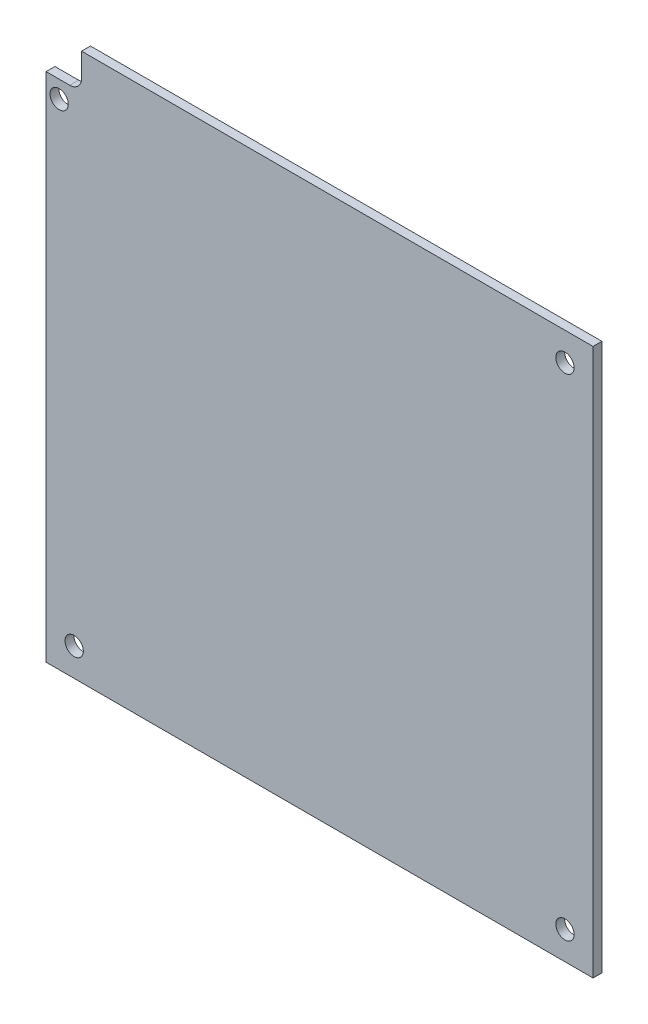
from build123d import *

# Parameters (mm, degrees)
SKETCH1_W                  = 92.5
SKETCH1_H                  = 92.5
BOSS_EXTRUDE1_DEPTH        = 1.5
F_3_1_3_1_DIAMETER_HOLE1_D = 3.1
CUT_EXTRUDE1_DEPTH         = 10


with BuildPart() as part:
    # Sketch1 → Boss-Extrude1 (new body)
    with BuildSketch(Plane.XY):
        Rectangle(SKETCH1_W, SKETCH1_H)
    extrude(amount=BOSS_EXTRUDE1_DEPTH)

    # Ø3.1 (3.1) Diameter Hole1 (through all)
    with Locations(Plane.XY.offset(1.5)):
        with Locations((-44.05, 37.328004442), (41.5, 41.5), (41.5, -41.5), (-41.5, -41.5)):
            Hole(F_3_1_3_1_DIAMETER_HOLE1_D / 2)

    # Sketch6 → Cut-Extrude1 (cut)
    with BuildSketch(Plane(origin=(0, 0, 0), x_dir=(-1, 0, 0), z_dir=(0, 0, -1))):
        with BuildLine():
            Line((46.25, 46.25), (40.25, 46.25))
            Line((40.25, 46.25), (40.25, 42.25))
            ThreePointArc((40.25, 42.25), (40.835786438, 40.835786438), (42.25, 40.25))
            Line((42.25, 40.25), (46.25, 40.25))
            Line((46.25, 40.25), (46.25, 46.25))
        make_face()
    extrude(amount=-CUT_EXTRUDE1_DEPTH, mode=Mode.SUBTRACT)


solid = part.part
